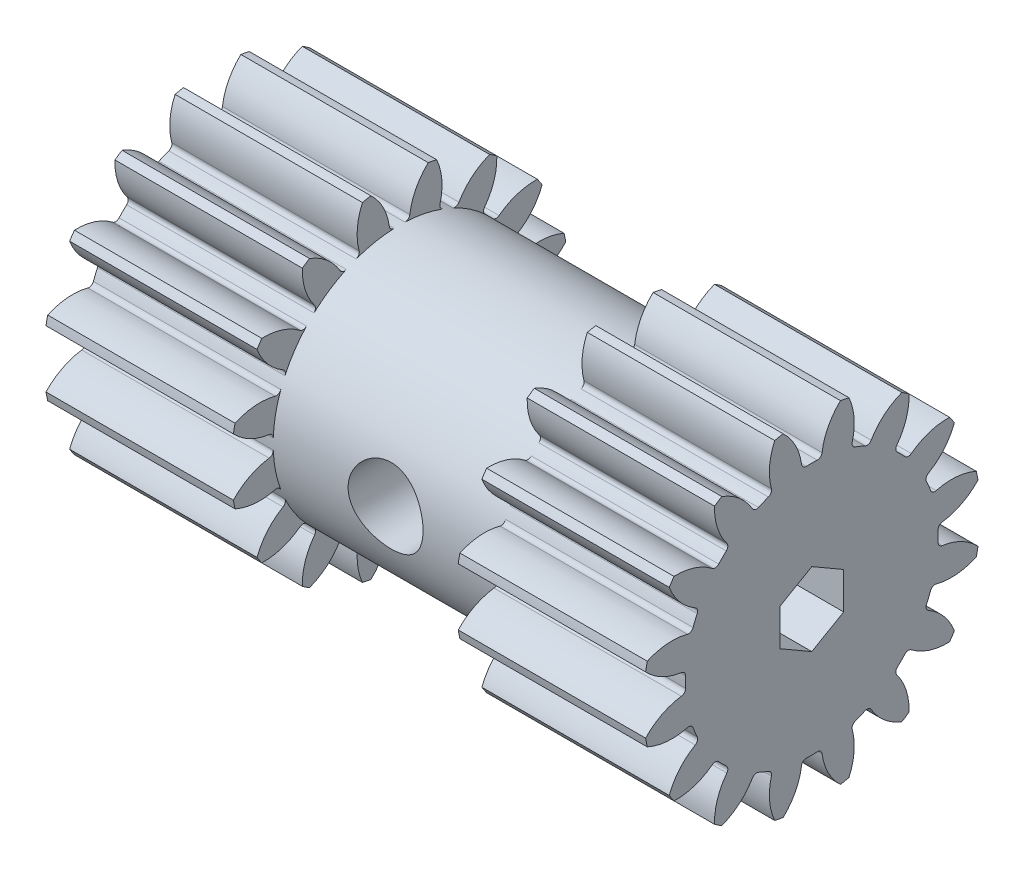
from build123d import *
from build123d.topology import SkipClean

# Parameters (mm, degrees)
BASPROSKE_W                = 16
BASPROSKE_H                = 4.5
TOOTHCUT_DEPTH             = 18.219175358
ROOTFILLETS_R              = 0.126
TEETHCUTS_COUNT            = 16
ROOTFILLETS_OF_TEETHCUTS_R = 0.126
SHAFTHOLE_DEPTH            = 18.185157524
SCREWHOLE_DEPTH            = 18.423857049
SCREWHOLE_DEPTH_BACK       = 18.423857049
SCREWHOLESKE_R             = 1
CUTSKE_R                   = 4.5
CUTSKE_R_2                 = 3.374
CUT_DEPTH                  = 3


with BuildPart() as part:
    # BasProSke → Base-Revolve (revolve)
    with BuildSketch(Plane(origin=(0, 0, 0), x_dir=(1, 0, 0), z_dir=(0, 1, 0)), mode=Mode.PRIVATE) as base_revolve_sk:
        with Locations((8, 2.25)):
            Rectangle(BASPROSKE_W, BASPROSKE_H)
    revolve(base_revolve_sk.sketch.rotate(Axis((-10, 0, 0), (1, 0, 0)), 180), axis=Axis((-10, 0, 0), (1, 0, 0)))

    # TooCutSke → ToothCut (cut, through all)
    with BuildSketch(Plane(origin=(0, 0, 0), x_dir=(0, 0, -1), z_dir=(1, 0, 0))):
        with BuildLine():
            ThreePointArc((0.261866103, 3.363822549), (0, 3.374), (-0.261866103, 3.363822549))
            ThreePointArc((-0.261866103, 3.363822549), (-0.417714668, 3.961827375), (-0.788562282, 4.456165918))
            ThreePointArc((-0.788562282, 4.456165918), (0, 4.5254), (0.788562282, 4.456165918))
            ThreePointArc((0.788562282, 4.456165918), (0.417714668, 3.961827375), (0.261866103, 3.363822549))
        make_face()
    toothcut = extrude(amount=TOOTHCUT_DEPTH, mode=Mode.SUBTRACT)

    # RootFillets
    rootfillets_edges = [part.edges().sort_by_distance(p)[0] for p in [
        (8, 3.363822549, -0.261866103),
        (8, 3.363822549, 0.261866103),
    ]]
    fillet(rootfillets_edges, radius=ROOTFILLETS_R)

    # TeethCuts: ToothCut ×16 about axis
    teethcuts_axis = Axis((0, 0, 0), (1, 0, 0))
    for i in range(1, TEETHCUTS_COUNT):
        add(toothcut.rotate(teethcuts_axis, i * 360 / TEETHCUTS_COUNT), mode=Mode.SUBTRACT)

    # RootFillets of TeethCuts
    rootfillets_of_teethcuts_edges = [part.edges().sort_by_distance(p)[0] for p in [
        (8, 3.207978624, 1.045346426),
        (8, 3.007554985, 1.529211892),
        (8, 2.563749033, 2.193414438),
        (8, 2.193414438, 2.563749033),
        (8, 1.529211892, 3.007554985),
        (8, 1.045346426, 3.207978624),
        (8, 0.261866103, 3.363822549),
        (8, -0.261866103, 3.363822549),
        (8, -1.045346426, 3.207978624),
        (8, -1.529211892, 3.007554985),
        (8, -2.193414438, 2.563749033),
        (8, -2.563749033, 2.193414438),
        (8, -3.007554985, 1.529211892),
        (8, -3.207978624, 1.045346426),
        (8, -3.363822549, 0.261866103),
        (8, -3.363822549, -0.261866103),
        (8, -3.207978624, -1.045346426),
        (8, -3.007554985, -1.529211892),
        (8, -2.563749033, -2.193414438),
        (8, -2.193414438, -2.563749033),
        (8, -1.529211892, -3.007554985),
        (8, -1.045346426, -3.207978624),
        (8, -0.261866103, -3.363822549),
        (8, 0.261866103, -3.363822549),
        (8, 1.045346426, -3.207978624),
        (8, 1.529211892, -3.007554985),
        (8, 2.193414438, -2.563749033),
        (8, 2.563749033, -2.193414438),
        (8, 3.007554985, -1.529211892),
        (8, 3.207978624, -1.045346426),
    ]]
    fillet(rootfillets_of_teethcuts_edges, radius=ROOTFILLETS_OF_TEETHCUTS_R)

    # ShaftHoleSke → ShaftHole (cut, through all)
    with BuildSketch(Plane(origin=(16, 0, 0), x_dir=(0, 0, -1), z_dir=(1, 0, 0))):
        Polygon((0, 0.981495458), (-0.85, 0.490747729), (-0.85, -0.490747729), (0, -0.981495458), (0.85, -0.490747729), (0.85, 0.490747729), align=None)
    extrude(amount=-SHAFTHOLE_DEPTH, mode=Mode.SUBTRACT)

    # ScrewHoleSke → ScrewHole (cut, two sides: drawn at the far end of the back side and taken through both)
    with BuildSketch(Plane.XY.offset(-0.85).offset(-SCREWHOLE_DEPTH_BACK)):
        with Locations(Location((8, 0, 0), (0, 0, 351.779994722))):
            Circle(SCREWHOLESKE_R)
    extrude(amount=SCREWHOLE_DEPTH + SCREWHOLE_DEPTH_BACK, mode=Mode.SUBTRACT)

    # CutSke → Cut (cut, symmetric)
    with SkipClean():  # the faces are left unmerged after this step: merging them gives an invalid solid
        with BuildSketch(Plane(origin=(8, 0, 0), x_dir=(0, 0, -1), z_dir=(1, 0, 0))):
            Circle(CUTSKE_R)
            with Locations(Location((0, 0, 0), (0, 0, 177.571342675))):
                Circle(CUTSKE_R_2, mode=Mode.SUBTRACT)
        extrude(amount=CUT_DEPTH, both=True, mode=Mode.SUBTRACT)


solid = part.part
